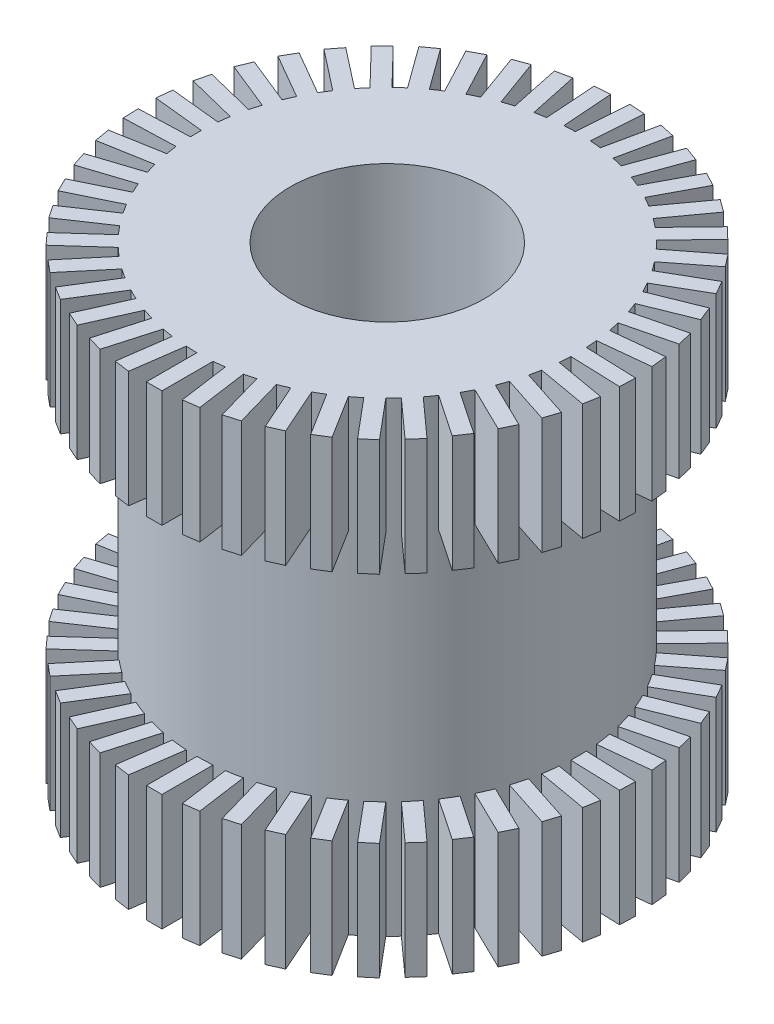
from build123d import *

# Parameters (mm, degrees)
SKETCH1_R                       = 2.45
BOSS_EXTRUDE1_DEPTH             = 6
M3X0_5_TAPPED_HOLE1_D           = 2.5
SKETCH4_W                       = 0.2
SKETCH4_H                       = 1.5
BOSS_EXTRUDE2_DEPTH             = 0.1
BOSS_EXTRUDE2_DIRECTION_2_REACH = 10.468
CIRPATTERN1_COUNT               = 45


with BuildPart() as part:
    # Sketch1 → Boss-Extrude1 (new body)
    with BuildSketch(Plane(origin=(0, 0, 0), x_dir=(1, 0, 0), z_dir=(0, 1, 0))):
        with Locations(Location((0, 0, 0), (0, 0, 270))):
            Circle(SKETCH1_R)
    extrude(amount=BOSS_EXTRUDE1_DEPTH)

    # M3x0.5 Tapped Hole1 (through all)
    with Locations(Plane(origin=(0, 6, 0), x_dir=(1, 0, 0), z_dir=(0, 1, 0))):
        with Locations((0, 0)):
            Hole(M3X0_5_TAPPED_HOLE1_D / 2)

    # Sketch4 → Boss-Extrude2 (add)
    with BuildSketch(Plane.XY.offset(3)):
        with Locations((0.1, 5.25)):
            Rectangle(SKETCH4_W, SKETCH4_H)
        with Locations((0.1, 0.75)):
            Rectangle(SKETCH4_W, SKETCH4_H)
    boss_extrude2 = extrude(amount=BOSS_EXTRUDE2_DEPTH)

    # Sketch4 → Boss-Extrude2 direction 2 (add, up to next)
    with BuildSketch(Plane.XY.offset(3), mode=Mode.PRIVATE) as boss_extrude2_direction_2_sk1:
        with Locations((0.1, 5.25)):
            Rectangle(SKETCH4_W, SKETCH4_H)
    boss_extrude2_direction_2_tool1 = extrude(boss_extrude2_direction_2_sk1.sketch, amount=-BOSS_EXTRUDE2_DIRECTION_2_REACH, mode=Mode.PRIVATE) - part.part
    # Sketch4 → Boss-Extrude2 direction 2 (add, up to next)
    with BuildSketch(Plane.XY.offset(3), mode=Mode.PRIVATE) as boss_extrude2_direction_2_sk2:
        with Locations((0.1, 0.75)):
            Rectangle(SKETCH4_W, SKETCH4_H)
    boss_extrude2_direction_2_tool2 = extrude(boss_extrude2_direction_2_sk2.sketch, amount=-BOSS_EXTRUDE2_DIRECTION_2_REACH, mode=Mode.PRIVATE) - part.part
    boss_extrude2_direction_2_1 = boss_extrude2_direction_2_tool1.solids().sort_by_distance((0.1, 5.25, 3))[0]
    add(boss_extrude2_direction_2_1)
    boss_extrude2_direction_2_2 = boss_extrude2_direction_2_tool2.solids().sort_by_distance((0.1, 0.75, 3))[0]
    add(boss_extrude2_direction_2_2)
    boss_extrude2_direction_2 = boss_extrude2_direction_2_1 + boss_extrude2_direction_2_2  # Boss-Extrude2 direction 2 as one shape, for the pattern or mirror that repeats it

    # CirPattern1: Boss-Extrude2, Boss-Extrude2 direction 2 ×45 about axis
    cirpattern1_axis = Axis((0, 0, 0), (0, 1, 0))
    add([boss_extrude2.rotate(cirpattern1_axis, i * 360 / CIRPATTERN1_COUNT) for i in range(1, CIRPATTERN1_COUNT)])
    add([boss_extrude2_direction_2.rotate(cirpattern1_axis, i * 360 / CIRPATTERN1_COUNT) for i in range(1, CIRPATTERN1_COUNT)])


solid = part.part
